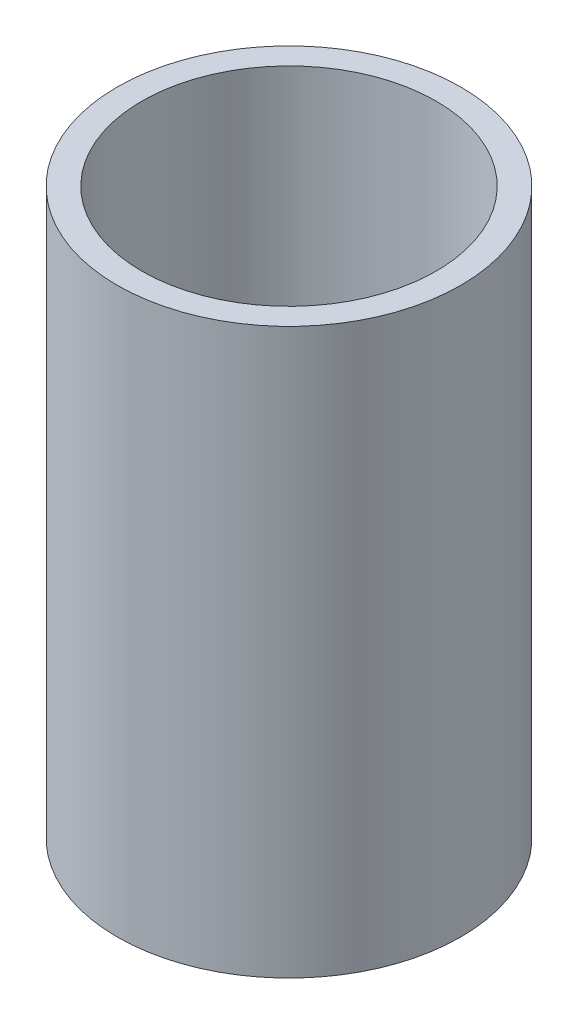
from build123d import *

# Parameters (mm, degrees)
SKETCH1_R           = 3.5
SKETCH1_R_2         = 3
BOSS_EXTRUDE1_DEPTH = 11.5


with BuildPart() as part:
    # Sketch1 → Boss-Extrude1 (new body)
    with BuildSketch(Plane(origin=(0, 0, 0), x_dir=(1, 0, 0), z_dir=(0, 1, 0))):
        with Locations(Location((0, 0, 0), (0, 0, 270))):
            Circle(SKETCH1_R)
        with Locations(Location((0, 0, 0), (0, 0, 270))):
            Circle(SKETCH1_R_2, mode=Mode.SUBTRACT)
    extrude(amount=BOSS_EXTRUDE1_DEPTH)


solid = part.part
